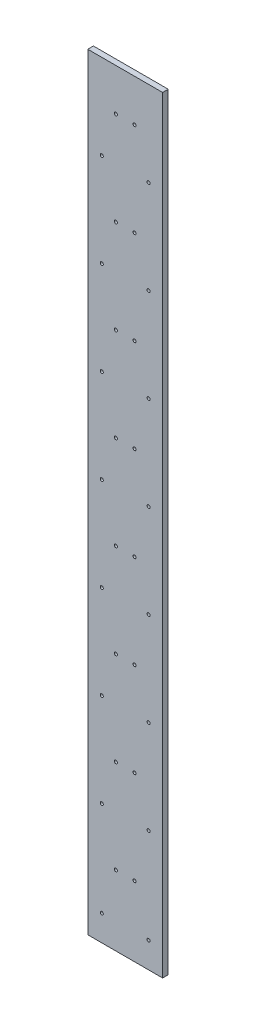
from build123d import *

# Parameters (mm, degrees)
SKETCH1_W               = 160
SKETCH1_H               = 1640
BOSS_EXTRUDE1_DEPTH     = 12
CUT_EXTRUDE1_DEPTH      = 1642.993909855
CUT_EXTRUDE1_DEPTH_BACK = 1642.993909855
SKETCH2_R               = 3.3
CUT_EXTRUDE2_DEPTH      = 1642.993909855
CUT_EXTRUDE2_DEPTH_BACK = 1642.993909855
SKETCH3_R               = 3.3
SKETCH4_R               = 5.5
CUT_EXTRUDE4_DEPTH      = 6.5


with BuildPart() as part:
    # Sketch1 → Boss-Extrude1 (new body)
    with BuildSketch(Plane.XY):
        with Locations((0, 820)):
            Rectangle(SKETCH1_W, SKETCH1_H)
    extrude(amount=BOSS_EXTRUDE1_DEPTH)

    # Sketch2 → Cut-Extrude1 (cut, two sides: drawn at the far end of the back side and taken through both)
    with BuildSketch(Plane.XY.offset(-CUT_EXTRUDE1_DEPTH_BACK)):
        with Locations((-50, 55)):
            Circle(SKETCH2_R)
        with Locations((-50, 258)):
            Circle(SKETCH2_R)
        with Locations((-50, 458)):
            Circle(SKETCH2_R)
        with Locations((-50, 658)):
            Circle(SKETCH2_R)
        with Locations((-50, 858)):
            Circle(SKETCH2_R)
        with Locations((-50, 1058)):
            Circle(SKETCH2_R)
        with Locations((-50, 1258)):
            Circle(SKETCH2_R)
        with Locations((-50, 1458)):
            Circle(SKETCH2_R)
        with Locations((50, 55)):
            Circle(SKETCH2_R)
        with Locations((50, 258)):
            Circle(SKETCH2_R)
        with Locations((50, 458)):
            Circle(SKETCH2_R)
        with Locations((50, 658)):
            Circle(SKETCH2_R)
        with Locations((50, 858)):
            Circle(SKETCH2_R)
        with Locations((50, 1058)):
            Circle(SKETCH2_R)
        with Locations((50, 1258)):
            Circle(SKETCH2_R)
        with Locations((50, 1458)):
            Circle(SKETCH2_R)
    extrude(amount=CUT_EXTRUDE1_DEPTH + CUT_EXTRUDE1_DEPTH_BACK, mode=Mode.SUBTRACT)

    # Sketch3 → Cut-Extrude2 (cut, two sides: drawn at the far end of the back side and taken through both)
    with BuildSketch(Plane.XY.offset(-CUT_EXTRUDE2_DEPTH_BACK)):
        with Locations((-20, 150)):
            Circle(SKETCH3_R)
        with Locations((-20, 350)):
            Circle(SKETCH3_R)
        with Locations((-20, 550)):
            Circle(SKETCH3_R)
        with Locations((-20, 750)):
            Circle(SKETCH3_R)
        with Locations((-20, 950)):
            Circle(SKETCH3_R)
        with Locations((-20, 1150)):
            Circle(SKETCH3_R)
        with Locations((-20, 1350)):
            Circle(SKETCH3_R)
        with Locations((-20, 1550)):
            Circle(SKETCH3_R)
        with Locations((20, 150)):
            Circle(SKETCH3_R)
        with Locations((20, 350)):
            Circle(SKETCH3_R)
        with Locations((20, 550)):
            Circle(SKETCH3_R)
        with Locations((20, 750)):
            Circle(SKETCH3_R)
        with Locations((20, 950)):
            Circle(SKETCH3_R)
        with Locations((20, 1150)):
            Circle(SKETCH3_R)
        with Locations((20, 1350)):
            Circle(SKETCH3_R)
        with Locations((20, 1550)):
            Circle(SKETCH3_R)
    extrude(amount=CUT_EXTRUDE2_DEPTH + CUT_EXTRUDE2_DEPTH_BACK, mode=Mode.SUBTRACT)

    # Sketch4 → Cut-Extrude4 (cut)
    with BuildSketch(Plane.XY):
        with Locations((-20, 150)):
            Circle(SKETCH4_R)
        with Locations((-20, 350)):
            Circle(SKETCH4_R)
        with Locations((-20, 550)):
            Circle(SKETCH4_R)
        with Locations((-20, 750)):
            Circle(SKETCH4_R)
        with Locations((-20, 950)):
            Circle(SKETCH4_R)
        with Locations((-20, 1150)):
            Circle(SKETCH4_R)
        with Locations((-20, 1350)):
            Circle(SKETCH4_R)
        with Locations((-20, 1550)):
            Circle(SKETCH4_R)
        with Locations((20, 150)):
            Circle(SKETCH4_R)
        with Locations((20, 350)):
            Circle(SKETCH4_R)
        with Locations((20, 550)):
            Circle(SKETCH4_R)
        with Locations((20, 750)):
            Circle(SKETCH4_R)
        with Locations((20, 950)):
            Circle(SKETCH4_R)
        with Locations((20, 1150)):
            Circle(SKETCH4_R)
        with Locations((20, 1350)):
            Circle(SKETCH4_R)
        with Locations((20, 1550)):
            Circle(SKETCH4_R)
    extrude(amount=CUT_EXTRUDE4_DEPTH, mode=Mode.SUBTRACT)


solid = part.part
